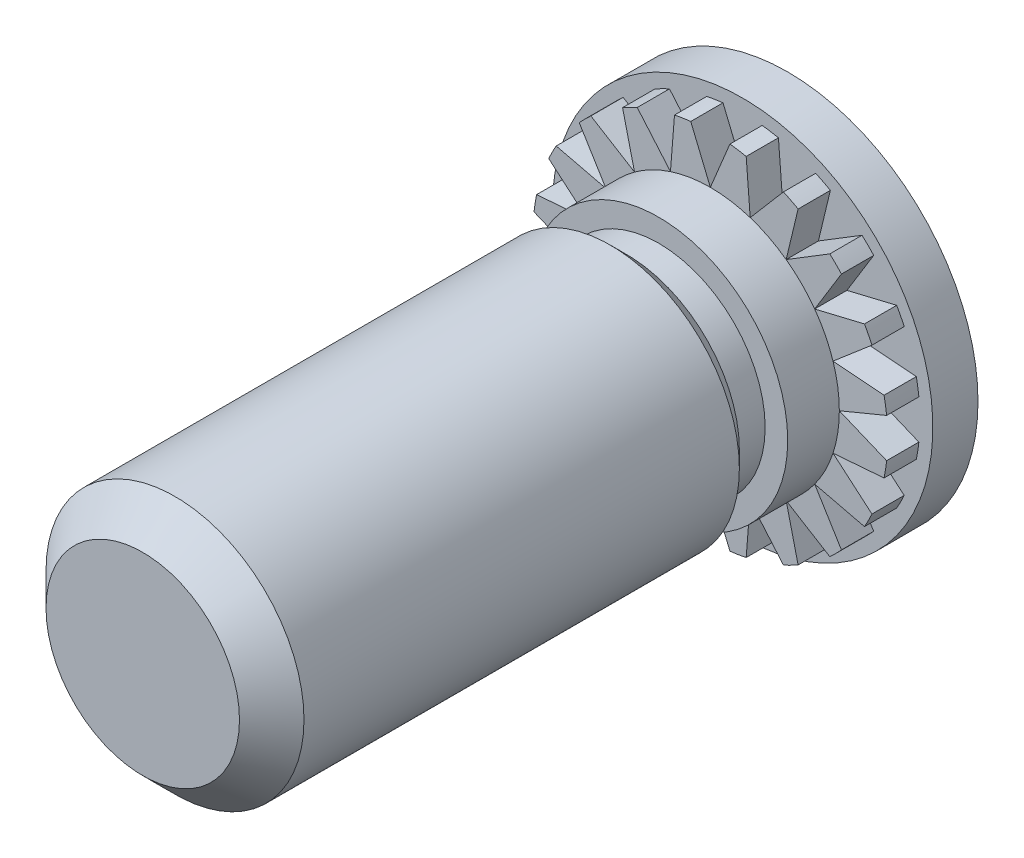
from build123d import *

# Parameters (mm, degrees)
SKETCH_1_R               = 2.95
EXTRUDE_1_DEPTH          = 1.2
SKETCH_2_R               = 2
EXTRUDE_2_DEPTH          = 1.9
CUT_EXTRUDE_1_DEPTH      = 0.5
PATTERN_CIRCULAR_1_COUNT = 20
SKETCH_4_W               = 0.35
SKETCH_4_H               = 0.5
SKETCH_6_W               = 6.9
SKETCH_6_H               = 2
CHAMFER_2_SIZE           = 0.5
CUT_EXTRUDE_START        = -0.5
SKETCH_7_R               = 2.95
SKETCH_7_R_2             = 2.75
CUT_EXTRUDE_2_DEPTH      = 0.5
CHAMFER_3_SIZE           = 0.25


with BuildPart() as part:
    # Эскиз1 → Вытянуть1 (new body)
    with BuildSketch(Plane.XY):
        Circle(SKETCH_1_R)
    extrude(amount=EXTRUDE_1_DEPTH)

    # Эскиз2 → Вытянуть2 (add)
    with BuildSketch(Plane.XY.offset(1.2)):
        with Locations(Location((0, 0, 0), (0, 0, 180))):
            Circle(SKETCH_2_R)
    extrude(amount=EXTRUDE_2_DEPTH)

    # Эскиз3 → Вырез-Вытянуть1 (cut)
    with BuildSketch(Plane.XY.offset(1.2)):
        Polygon((-0.393502884, 2.95), (0.393502884, 2.95), (0, 2), align=None)
    cut_extrude_1 = extrude(amount=-CUT_EXTRUDE_1_DEPTH, mode=Mode.SUBTRACT)

    # Круговой массив1: Вырез-Вытянуть1 ×20 about axis
    pattern_circular_1_axis = Axis((0, 0, 0), (0, 0, 1))
    for i in range(1, PATTERN_CIRCULAR_1_COUNT):
        add(cut_extrude_1.rotate(pattern_circular_1_axis, i * 360 / PATTERN_CIRCULAR_1_COUNT), mode=Mode.SUBTRACT)

    # Эскиз4 → Вырез-Повернуть1 (revolve, cut)
    with BuildSketch(Plane(origin=(0, 0, 0), x_dir=(1, 0, 0), z_dir=(0, 1, 0)), mode=Mode.PRIVATE) as cut_revolve_1_sk:
        with Locations((1.825, -2.25)):
            Rectangle(SKETCH_4_W, SKETCH_4_H)
    revolve(cut_revolve_1_sk.sketch.rotate(Axis((0, 0, 10.642619983), (0, 0, -1)), 172.537215717), axis=Axis((0, 0, 10.642619983), (0, 0, -1)), mode=Mode.SUBTRACT)

    # Эскиз6 → Повернуть1 (revolve)
    with BuildSketch(Plane(origin=(0, 0, 0), x_dir=(0, 0, -1), z_dir=(1, 0, 0)), mode=Mode.PRIVATE) as revolve_1_sk:
        with Locations((-6.55, -1)):
            Rectangle(SKETCH_6_W, SKETCH_6_H)
    revolve(revolve_1_sk.sketch.rotate(Axis((0, 0, 3.1), (0, 0, 1)), 277.462784283), axis=Axis((0, 0, 3.1), (0, 0, 1)))

    # Фаска2
    chamfer_2_edges = [part.edges().sort_by_distance(p)[0] for p in [
        (1.983058868, 0.25976437, 10),
    ]]
    chamfer(chamfer_2_edges, length=CHAMFER_2_SIZE)

    # Эскиз7 → Вырез-Вытянуть2 (cut)
    with BuildSketch(Plane.XY.offset(1.2).offset(CUT_EXTRUDE_START)):
        with Locations(Location((0, 0, 0), (0, 0, 180))):
            Circle(SKETCH_7_R)
        Circle(SKETCH_7_R_2, mode=Mode.SUBTRACT)
    extrude(amount=CUT_EXTRUDE_2_DEPTH, mode=Mode.SUBTRACT)

    # Фаска3
    chamfer_3_edges = [part.edges().sort_by_distance(p)[0] for p in [
        (2, 0, 2.5),
    ]]
    chamfer(chamfer_3_edges, length=CHAMFER_3_SIZE)


solid = part.part
